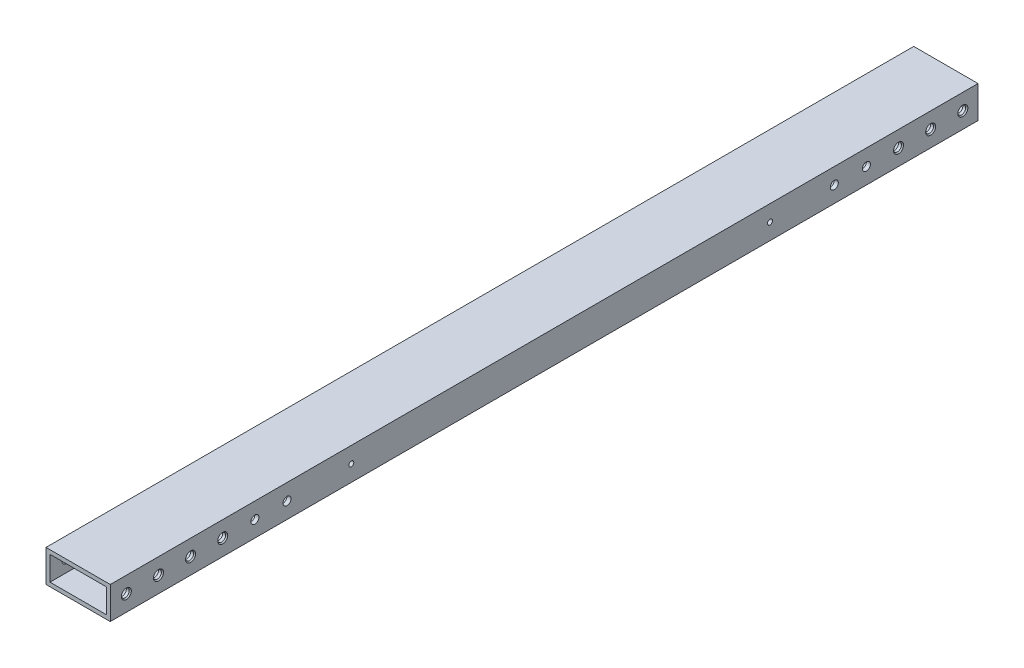
from build123d import *

# Parameters (mm, degrees)
BOSS_EXTRUDE1_DEPTH                   = 342.9
BOSS_EXTRUDE1_DEPTH_BACK              = 342.9
SKETCH3_W                             = 50.8
SKETCH3_H                             = 25.4
SKETCH3_W_2                           = 44.45
SKETCH3_H_2                           = 19.05
F_1_4_0_25_DIAMETER_HOLE4_AT_2_COUNT  = 2
F_1_4_0_25_DIAMETER_HOLE4_AT_2_PITCH  = 25.4
F_1_4_0_25_DIAMETER_HOLE5_D           = 6.35
F_1_4_0_25_DIAMETER_HOLE5_CSINK_D     = 7.9248
F_1_4_0_25_DIAMETER_HOLE5_CSINK_ANGLE = 82
F_1_4_0_25_DIAMETER_HOLE6_D           = 6.35
F_1_4_0_25_DIAMETER_HOLE7_D           = 6.35
F_1_4_0_25_DIAMETER_HOLE8_D           = 6.35
F_1_4_0_25_DIAMETER_HOLE8_CSINK_D     = 7.9248
F_1_4_0_25_DIAMETER_HOLE8_CSINK_ANGLE = 82
F_5_32_0_15625_DIAMETER_HOLE1_D       = 3.96875


with BuildPart() as part:
    # Sketch3 → Boss-Extrude1 (new, two sides: drawn at the far end of the back side and taken through both)
    with BuildSketch(Plane.XY.offset(-BOSS_EXTRUDE1_DEPTH_BACK)):
        Rectangle(SKETCH3_W, SKETCH3_H)
        Rectangle(SKETCH3_W_2, SKETCH3_H_2, mode=Mode.SUBTRACT)
    extrude(amount=BOSS_EXTRUDE1_DEPTH + BOSS_EXTRUDE1_DEPTH_BACK)

    # Sketch13 → 1/4 (0.25) Diameter Hole3 (revolve, cut)
    with BuildSketch(Plane(origin=(-25.4, 0, -330.911799988), x_dir=(0, 0, 1), z_dir=(0, 1, 0))):
        Polygon((0, 0), (0, 50.8), (3.9624, 50.8), (3.175, 49.894199916), (3.175, 0), align=None)
    revolve(axis=Axis((-31.75, 0, -330.911799988), (1, 0, 0)), mode=Mode.SUBTRACT)

    # Sketch15 → 1/4 (0.25) Diameter Hole4 (revolve, cut)
    with BuildSketch(Plane(origin=(-25.4, 0, 304.8), x_dir=(0, 0, 1), z_dir=(0, 1, 0))):
        Polygon((0, 0), (0, 50.8), (3.9624, 50.8), (3.175, 49.894199916), (3.175, 0), align=None)
    f_1_4_0_25_diameter_hole4 = revolve(axis=Axis((-31.75, 0, 304.8), (1, 0, 0)), mode=Mode.SUBTRACT)

    # 1/4 (0.25) Diameter Hole4 at 2: 1/4 (0.25) Diameter Hole4 ×2
    with Locations(*[(0, 0, i * F_1_4_0_25_DIAMETER_HOLE4_AT_2_PITCH) for i in range(1, F_1_4_0_25_DIAMETER_HOLE4_AT_2_COUNT)]):
        add(f_1_4_0_25_diameter_hole4, mode=Mode.SUBTRACT)

    # 1/4 (0.25) Diameter Hole5 (through all)
    with Locations(Plane(origin=(25.4, 0, 0), x_dir=(0, 0, -1), z_dir=(1, 0, 0))):
        with Locations((305.511799988, 0), (280.111799988, 0)):
            CounterSinkHole(F_1_4_0_25_DIAMETER_HOLE5_D / 2, F_1_4_0_25_DIAMETER_HOLE5_CSINK_D / 2, counter_sink_angle=F_1_4_0_25_DIAMETER_HOLE5_CSINK_ANGLE)

    # 1/4 (0.25) Diameter Hole6 (through all)
    with Locations(Plane(origin=(25.4, 0, 0), x_dir=(0, 0, -1), z_dir=(1, 0, 0))):
        with Locations((229.311799988, 0), (254.711799988, 0)):
            Hole(F_1_4_0_25_DIAMETER_HOLE6_D / 2)

    # 1/4 (0.25) Diameter Hole7 (through all)
    with Locations(Plane(origin=(25.4, 0, 0), x_dir=(0, 0, -1), z_dir=(1, 0, 0))):
        with Locations((-203.2, 0), (-228.6, 0)):
            Hole(F_1_4_0_25_DIAMETER_HOLE7_D / 2)

    # 1/4 (0.25) Diameter Hole8 (through all)
    with Locations(Plane(origin=(25.4, 0, 0), x_dir=(0, 0, -1), z_dir=(1, 0, 0))):
        with Locations((-279.4, 0), (-254, 0)):
            CounterSinkHole(F_1_4_0_25_DIAMETER_HOLE8_D / 2, F_1_4_0_25_DIAMETER_HOLE8_CSINK_D / 2, counter_sink_angle=F_1_4_0_25_DIAMETER_HOLE8_CSINK_ANGLE)

    # 5/32 (0.15625) Diameter Hole1 (through all)
    with Locations(Plane(origin=(25.4, 0, 0), x_dir=(0, 0, -1), z_dir=(1, 0, 0))):
        with Locations((-152.4, 0), (178.511799988, 0)):
            Hole(F_5_32_0_15625_DIAMETER_HOLE1_D / 2)


solid = part.part
